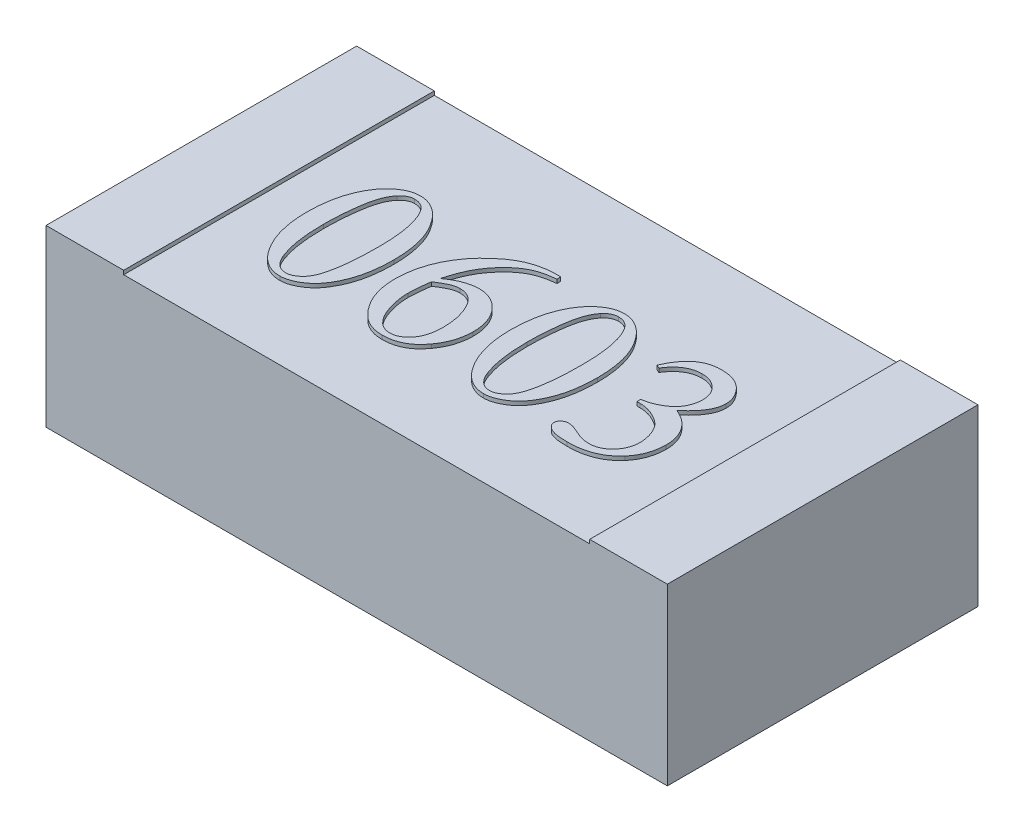
from build123d import *

# Parameters (mm, degrees)
SKETCH_1_W          = 1.6
SKETCH_1_H          = 0.8
EXTRUDE_1_DEPTH     = 0.45
SKETCH_2_W          = 1.2
SKETCH_2_H          = 0.8
CUT_EXTRUDE_1_DEPTH = 0.01
EXTRUDE_2_DEPTH     = 0.01


with BuildPart() as part:
    # 草图1 → 凸台-拉伸1 (new body)
    with BuildSketch(Plane(origin=(0, 0, 0), x_dir=(1, 0, 0), z_dir=(0, 1, 0))):
        Rectangle(SKETCH_1_W, SKETCH_1_H)
    extrude(amount=EXTRUDE_1_DEPTH)

    # 草图2 → 切除-拉伸1 (cut)
    with BuildSketch(Plane(origin=(0, 0.45, 0), x_dir=(1, 0, 0), z_dir=(0, 1, 0))):
        Rectangle(SKETCH_2_W, SKETCH_2_H)
    extrude(amount=-CUT_EXTRUDE_1_DEPTH, mode=Mode.SUBTRACT)

    # 草图3 → 凸台-拉伸2 (add)
    # profile 1 of 4: a face of its own
    with BuildSketch(Plane(origin=(0, 0.44, 0), x_dir=(1, 0, 0), z_dir=(0, 1, 0))):
        with BuildLine():
            add(Edge.make_bspline(
                [(-0.494038629, -0.034463866), (-0.493968385, -0.029601954), (-0.493830375, -0.020049566), (-0.493097196, -0.00598145), (-0.49173956, 0.00758151), (-0.48974573, 0.020598735), (-0.487324602, 0.033124998), (-0.484397191, 0.045135649), (-0.48080673, 0.056611876), (-0.476729874, 0.067545349), (-0.47212909, 0.077848338), (-0.4673588, 0.087614212), (-0.461962002, 0.096578117), (-0.456392899, 0.104936504), (-0.450451285, 0.112626124), (-0.44401515, 0.119496867), (-0.437397972, 0.125899304), (-0.432554568, 0.129544074), (-0.43016059, 0.131345596)],
                knots=[0, 0, 0, 0, 1.267948223, 2.491187271, 3.672419621, 4.820944812, 5.924168987, 6.998668076, 8.042818115, 9.058224754, 10.039662809, 10.984530588, 11.890392543, 12.765710998, 13.603053422, 14.420720048, 15.219399938, 16, 16, 16, 16], degree=3))
            add(Edge.make_bspline(
                [(-0.43016059, 0.131345596), (-0.426460667, 0.133901348), (-0.419303869, 0.138844964), (-0.407628386, 0.144027973), (-0.395809297, 0.147342191), (-0.387798717, 0.147768435), (-0.383828125, 0.14797971)],
                knots=[0, 0, 0, 0, 1.076116545, 2.081542914, 3.049081206, 4, 4, 4, 4], degree=3))
            add(Edge.make_bspline(
                [(-0.383828125, 0.14797971), (-0.380602993, 0.147871194), (-0.374196746, 0.147655644), (-0.364741001, 0.145658828), (-0.355548113, 0.142447415), (-0.346637275, 0.137912728), (-0.337975948, 0.132147443), (-0.329609283, 0.125083767), (-0.32145717, 0.11680222), (-0.316500602, 0.110557678), (-0.313949653, 0.10734386)],
                knots=[0, 0, 0, 0, 0.921550053, 1.830522441, 2.751246923, 3.70019056, 4.682375705, 5.720881843, 6.827028318, 8, 8, 8, 8], degree=3))
            add(Edge.make_bspline(
                [(-0.313949653, 0.10734386), (-0.310851281, 0.103019951), (-0.304595542, 0.094289804), (-0.296671142, 0.079967158), (-0.290130456, 0.064474366), (-0.28459456, 0.047937204), (-0.280503931, 0.030246538), (-0.277451496, 0.011474504), (-0.27562, -0.008425612), (-0.275400849, -0.022079364), (-0.275288629, -0.029071071)],
                knots=[0, 0, 0, 0, 0.883963831, 1.784759013, 2.714530965, 3.677036329, 4.680787027, 5.730006124, 6.837599228, 8, 8, 8, 8], degree=3))
            add(Edge.make_bspline(
                [(-0.275288629, -0.029071071), (-0.275314862, -0.034009796), (-0.275366293, -0.043692257), (-0.276286492, -0.057925108), (-0.277483848, -0.071598322), (-0.279454054, -0.084684381), (-0.281731154, -0.097256968), (-0.284744028, -0.109225305), (-0.288092987, -0.12067522), (-0.292168255, -0.131438282), (-0.296554854, -0.141563279), (-0.301163316, -0.151064686), (-0.306208812, -0.159772786), (-0.311409698, -0.167863328), (-0.316962639, -0.175185097), (-0.3228429, -0.181750886), (-0.329001456, -0.187636907), (-0.335448916, -0.192760025), (-0.341957342, -0.197237708), (-0.348476967, -0.201052244), (-0.354902887, -0.204342763), (-0.361318056, -0.206983185), (-0.367607501, -0.209184335), (-0.373884632, -0.210577087), (-0.380074727, -0.211572593), (-0.384203995, -0.211686054), (-0.386258681, -0.211742512)],
                knots=[0, 0, 0, 0, 1.510050896, 2.960482548, 4.360412811, 5.706191847, 7.006128856, 8.266230485, 9.478809624, 10.652394328, 11.782968825, 12.852979618, 13.879641343, 14.858961868, 15.792780312, 16.68657793, 17.551917979, 18.394760493, 19.202293251, 19.965865945, 20.70343888, 21.408045917, 22.086293389, 22.738035093, 23.372058038, 24, 24, 24, 24], degree=3))
            add(Edge.make_bspline(
                [(-0.386258681, -0.211742512), (-0.390225217, -0.211573656), (-0.398077835, -0.211239369), (-0.409564014, -0.20835636), (-0.420563402, -0.203783309), (-0.430945682, -0.197188669), (-0.440827646, -0.188865434), (-0.450202369, -0.17873638), (-0.459015025, -0.166755835), (-0.464171682, -0.157867992), (-0.466846788, -0.153257269)],
                knots=[0, 0, 0, 0, 0.907345466, 1.796286953, 2.695609492, 3.62566933, 4.601329434, 5.647644493, 6.779674527, 8, 8, 8, 8], degree=3))
            add(Edge.make_bspline(
                [(-0.466846788, -0.153257269), (-0.469038525, -0.149085635), (-0.473464084, -0.140662264), (-0.478958835, -0.127335906), (-0.483612612, -0.113372447), (-0.487351251, -0.098788755), (-0.490450195, -0.083617174), (-0.492541655, -0.067806451), (-0.493749467, -0.051344877), (-0.493941014, -0.040162505), (-0.494038629, -0.034463866)],
                knots=[0, 0, 0, 0, 0.917887123, 1.853399498, 2.805111979, 3.783983157, 4.785434396, 5.820907986, 6.889514713, 8, 8, 8, 8], degree=3))
        make_face()
        with BuildLine():
            add(Edge.make_bspline(
                [(-0.445427517, -0.040540255), (-0.445356915, -0.046439985), (-0.445218985, -0.057965788), (-0.444503443, -0.074818119), (-0.443115203, -0.09082809), (-0.441243882, -0.106009818), (-0.438819155, -0.120381532), (-0.435890334, -0.13393365), (-0.432334491, -0.146633595), (-0.429493594, -0.154714095), (-0.428109809, -0.158650064)],
                knots=[0, 0, 0, 0, 1.180112402, 2.305485676, 3.372849049, 4.393553838, 5.364293091, 6.287088038, 7.165649773, 8, 8, 8, 8], degree=3))
            add(Edge.make_bspline(
                [(-0.428109809, -0.158650064), (-0.426908315, -0.161692293), (-0.424615523, -0.16749773), (-0.420326325, -0.175348484), (-0.415719637, -0.182075679), (-0.410564245, -0.187545378), (-0.405006634, -0.191926344), (-0.398875489, -0.194884758), (-0.39237794, -0.196837466), (-0.387868027, -0.197050743), (-0.385575087, -0.197159178)],
                knots=[0, 0, 0, 0, 1.27796888, 2.438728037, 3.490730404, 4.457262314, 5.368188585, 6.240469892, 7.105415757, 8, 8, 8, 8], degree=3))
            add(Edge.make_bspline(
                [(-0.385575087, -0.197159178), (-0.383278361, -0.197007611), (-0.378519322, -0.196693548), (-0.371422975, -0.194149005), (-0.36433268, -0.190060233), (-0.358405273, -0.185664446), (-0.353885542, -0.181192601), (-0.350475406, -0.177332518), (-0.34748734, -0.172774178), (-0.344603026, -0.167787617), (-0.341914658, -0.162262911), (-0.339534637, -0.156203815), (-0.337288407, -0.149623495), (-0.336073947, -0.145012171), (-0.335444879, -0.142623588)],
                knots=[0, 0, 0, 0, 1.037825602, 2.150474477, 3.371635047, 4.73778764, 5.475301301, 6.247273825, 7.064217381, 7.93705097, 8.854564737, 9.842063216, 10.882227619, 12, 12, 12, 12], degree=3))
            add(Edge.make_bspline(
                [(-0.335444879, -0.142623588), (-0.334493327, -0.138733246), (-0.332507988, -0.130616348), (-0.330227438, -0.11777594), (-0.328237237, -0.103818706), (-0.326696926, -0.088712825), (-0.325387118, -0.072456785), (-0.324505549, -0.05508111), (-0.323961983, -0.036568854), (-0.323920921, -0.023855913), (-0.32389974, -0.017298067)],
                knots=[0, 0, 0, 0, 0.761713504, 1.589256053, 2.479498212, 3.443272477, 4.477217009, 5.58167292, 6.752529866, 8, 8, 8, 8], degree=3))
            add(Edge.make_bspline(
                [(-0.32389974, -0.017298067), (-0.323913529, -0.012410805), (-0.323940618, -0.002809437), (-0.324606637, 0.011269921), (-0.325479238, 0.024722516), (-0.326747171, 0.037548694), (-0.328518667, 0.049725059), (-0.330547367, 0.061311068), (-0.332943363, 0.072270744), (-0.334929941, 0.079299933), (-0.335900608, 0.082734485)],
                knots=[0, 0, 0, 0, 1.160165125, 2.279225349, 3.345596166, 4.360583534, 5.338162882, 6.266121345, 7.152804842, 8, 8, 8, 8], degree=3))
            add(Edge.make_bspline(
                [(-0.335900608, 0.082734485), (-0.336663726, 0.085121794), (-0.338144231, 0.089753351), (-0.340655225, 0.09636963), (-0.343312686, 0.102454571), (-0.346092994, 0.108045259), (-0.349163487, 0.113023041), (-0.352227109, 0.11757216), (-0.355614905, 0.121474068), (-0.358035891, 0.123768436), (-0.35921875, 0.124889433)],
                knots=[0, 0, 0, 0, 1.233545328, 2.393169741, 3.481419258, 4.501374537, 5.463177041, 6.358578008, 7.198024365, 8, 8, 8, 8], degree=3))
            add(Edge.make_bspline(
                [(-0.35921875, 0.124889433), (-0.360972051, 0.126202702), (-0.364462914, 0.128817453), (-0.370551346, 0.131470152), (-0.377132924, 0.133108802), (-0.381716701, 0.133299206), (-0.38405599, 0.133396377)],
                knots=[0, 0, 0, 0, 0.978770933, 1.948756365, 2.953166656, 4, 4, 4, 4], degree=3))
            add(Edge.make_bspline(
                [(-0.38405599, 0.133396377), (-0.386843428, 0.133209014), (-0.392427541, 0.132833668), (-0.400445441, 0.129653603), (-0.407932695, 0.124563456), (-0.412145645, 0.119999012), (-0.414361979, 0.117597766)],
                knots=[0, 0, 0, 0, 0.945219573, 1.893571615, 2.891857598, 4, 4, 4, 4], degree=3))
            add(Edge.make_bspline(
                [(-0.414361979, 0.117597766), (-0.415844932, 0.115701487), (-0.418883336, 0.111816222), (-0.422819359, 0.105243214), (-0.426480628, 0.097978575), (-0.429622505, 0.089859885), (-0.432497899, 0.081033545), (-0.435120741, 0.071443365), (-0.43716864, 0.061046419), (-0.439572467, 0.04627263), (-0.441932965, 0.027359209), (-0.44382426, 0.004599453), (-0.445254952, -0.018014304), (-0.445370089, -0.033043792), (-0.445427517, -0.040540255)],
                knots=[0, 0, 0, 0, 0.529149883, 1.084168889, 1.682003891, 2.317081463, 2.996986461, 3.723908646, 4.502772949, 5.326906926, 7.016784336, 8.694047759, 10.351045161, 12, 12, 12, 12], degree=3))
        make_face(mode=Mode.SUBTRACT)
    # profile 2 of 4: a face of its own
    with BuildSketch(Plane(origin=(0, 0.44, 0), x_dir=(1, 0, 0), z_dir=(0, 1, 0))):
        with BuildLine():
            Line((-0.022510851, 0.14797971), (-0.022510851, 0.138257488))
            add(Edge.make_bspline(
                [(-0.022510851, 0.138257488), (-0.027761864, 0.1376464), (-0.037837491, 0.136473846), (-0.052137548, 0.133641605), (-0.064907179, 0.129820834), (-0.07645116, 0.125229403), (-0.087112569, 0.119395764), (-0.097503814, 0.11242483), (-0.107811591, 0.104105607), (-0.117940804, 0.094638449), (-0.127592617, 0.084235875), (-0.136500161, 0.073116074), (-0.144581937, 0.061408711), (-0.151776632, 0.048982031), (-0.158211413, 0.035664422), (-0.164018947, 0.021288676), (-0.169375173, 0.005753798), (-0.172354896, -0.005101548), (-0.173888889, -0.010689994)],
                knots=[0, 0, 0, 0, 1.112103864, 2.133901259, 3.062589416, 3.913366634, 4.74287887, 5.614630287, 6.543135065, 7.526908882, 8.529641219, 9.526369413, 10.522342764, 11.520138158, 12.544667767, 13.631892204, 14.7808733, 16, 16, 16, 16], degree=3))
            add(Edge.make_bspline(
                [(-0.173888889, -0.010689994), (-0.170856751, -0.008491322), (-0.164926914, -0.004191462), (-0.15567996, 0.001343595), (-0.146477483, 0.006081832), (-0.13727824, 0.009995845), (-0.128019942, 0.012977439), (-0.118768443, 0.015089307), (-0.109493998, 0.016453305), (-0.103306103, 0.016637586), (-0.100212674, 0.01672971)],
                knots=[0, 0, 0, 0, 1.123331773, 2.196857368, 3.229697486, 4.227207333, 5.192971132, 6.143860852, 7.072085882, 8, 8, 8, 8], degree=3))
            add(Edge.make_bspline(
                [(-0.100212674, 0.01672971), (-0.097295313, 0.016646342), (-0.091554159, 0.01648228), (-0.083097452, 0.015050945), (-0.074941196, 0.012782636), (-0.067065761, 0.009568771), (-0.059529318, 0.005423717), (-0.052230754, 0.000440697), (-0.04525657, -0.005490294), (-0.03870589, -0.01231295), (-0.032643375, -0.019782303), (-0.027296034, -0.027855459), (-0.022813409, -0.036468278), (-0.019142147, -0.045604703), (-0.016263001, -0.055239634), (-0.014220659, -0.065408129), (-0.012978153, -0.076081272), (-0.0128527, -0.08337536), (-0.012788629, -0.087100585)],
                knots=[0, 0, 0, 0, 0.926335326, 1.822960257, 2.716874761, 3.611657495, 4.518793541, 5.44474459, 6.414990309, 7.421923668, 8.445808242, 9.467636789, 10.493068566, 11.525261677, 12.591619706, 13.683314711, 14.816826316, 16, 16, 16, 16], degree=3))
            add(Edge.make_bspline(
                [(-0.012788629, -0.087100585), (-0.012845904, -0.09075078), (-0.012959238, -0.097973692), (-0.014341084, -0.108657689), (-0.016381684, -0.11908993), (-0.019168526, -0.129327068), (-0.022924349, -0.139298751), (-0.027521254, -0.149020244), (-0.032787982, -0.158573811), (-0.036964041, -0.16458351), (-0.039069011, -0.167612737)],
                knots=[0, 0, 0, 0, 1.016603262, 2.01162791, 2.996823361, 3.9776384, 4.964449423, 5.961847612, 6.972656258, 8, 8, 8, 8], degree=3))
            add(Edge.make_bspline(
                [(-0.039069011, -0.167612737), (-0.041724473, -0.171122744), (-0.046920797, -0.177991279), (-0.055898356, -0.186967699), (-0.065441124, -0.194665286), (-0.075666609, -0.200950706), (-0.086575853, -0.205738414), (-0.098053059, -0.209291825), (-0.110214573, -0.211360874), (-0.118535332, -0.211613768), (-0.122771267, -0.211742512)],
                knots=[0, 0, 0, 0, 1.070547348, 2.094894131, 3.081678243, 4.0500961, 5.007721965, 5.97488336, 6.96905275, 8, 8, 8, 8], degree=3))
            add(Edge.make_bspline(
                [(-0.122771267, -0.211742512), (-0.125686047, -0.211665925), (-0.131408715, -0.21151556), (-0.139829051, -0.210436545), (-0.147898269, -0.208627555), (-0.155635027, -0.206025576), (-0.16301632, -0.202649253), (-0.170116434, -0.198632413), (-0.176831983, -0.193835433), (-0.180935956, -0.190136116), (-0.183003472, -0.18827246)],
                knots=[0, 0, 0, 0, 1.054945317, 2.071203223, 3.06725916, 4.043942597, 5.020109906, 6.001126647, 6.992999677, 8, 8, 8, 8], degree=3))
            add(Edge.make_bspline(
                [(-0.183003472, -0.18827246), (-0.186893385, -0.184406284), (-0.194601454, -0.176745251), (-0.20444698, -0.163893557), (-0.212822248, -0.150247996), (-0.219660268, -0.135778838), (-0.225029515, -0.120458282), (-0.228786061, -0.104287278), (-0.23112649, -0.087270378), (-0.231399426, -0.07563912), (-0.231538629, -0.069706921)],
                knots=[0, 0, 0, 0, 0.996887487, 1.97538571, 2.93683217, 3.905260266, 4.881326787, 5.88466394, 6.921131994, 8, 8, 8, 8], degree=3))
            add(Edge.make_bspline(
                [(-0.231538629, -0.069706921), (-0.231474495, -0.065857109), (-0.231346924, -0.058199256), (-0.230496205, -0.046763785), (-0.229076128, -0.035476726), (-0.226982264, -0.024333616), (-0.22442503, -0.013351727), (-0.221292763, -0.002497091), (-0.217577581, 0.008207114), (-0.213245506, 0.018745813), (-0.208380878, 0.029050777), (-0.203080053, 0.039116499), (-0.197181463, 0.048834682), (-0.1909264, 0.058326882), (-0.184100713, 0.067480024), (-0.176856884, 0.076377128), (-0.168962369, 0.084865646), (-0.160793815, 0.093093316), (-0.152318187, 0.100754645), (-0.143921827, 0.107890186), (-0.135635397, 0.114388126), (-0.127402084, 0.120162759), (-0.119293906, 0.125356678), (-0.111230058, 0.129850435), (-0.103266315, 0.133665135), (-0.092907402, 0.137733834), (-0.080275958, 0.141797009), (-0.065416492, 0.145296171), (-0.051090002, 0.147578663), (-0.04168473, 0.147848169), (-0.037094184, 0.14797971)],
                knots=[0, 0, 0, 0, 1.006519091, 2.00211706, 2.996415824, 3.979256571, 4.965124328, 5.943496579, 6.931606334, 7.926081361, 8.921040949, 9.910081525, 10.898878399, 11.892118928, 12.881093046, 13.88292124, 14.890158396, 15.910556394, 16.913324523, 17.876166787, 18.79114971, 19.665330668, 20.504552116, 21.307593167, 22.077426548, 22.811271048, 24.215940873, 25.542181098, 26.800382202, 28, 28, 28, 28], degree=3))
            Line((-0.037094184, 0.14797971), (-0.022510851, 0.14797971))
        make_face()
        with BuildLine():
            add(Edge.make_bspline(
                [(-0.178066406, -0.029450845), (-0.1788074, -0.034941123), (-0.180215622, -0.045375127), (-0.181718563, -0.060218812), (-0.182719548, -0.073415045), (-0.182861296, -0.081655669), (-0.182927517, -0.085505533)],
                knots=[0, 0, 0, 0, 1.180646981, 2.243761695, 3.179518763, 4, 4, 4, 4], degree=3))
            add(Edge.make_bspline(
                [(-0.182927517, -0.085505533), (-0.182826551, -0.089713778), (-0.182619607, -0.09833912), (-0.180821912, -0.11150892), (-0.178094438, -0.12521698), (-0.174291092, -0.139141529), (-0.169561376, -0.152678965), (-0.163550382, -0.165022942), (-0.156424214, -0.175894389), (-0.150708348, -0.182064253), (-0.147912327, -0.185082355)],
                knots=[0, 0, 0, 0, 0.935169282, 1.916749931, 2.94995263, 4.040933046, 5.12340098, 6.132811626, 7.086630455, 8, 8, 8, 8], degree=3))
            add(Edge.make_bspline(
                [(-0.147912327, -0.185082355), (-0.145756904, -0.186960226), (-0.141518357, -0.19065298), (-0.133906539, -0.19435027), (-0.12572998, -0.196763695), (-0.12000435, -0.197025313), (-0.117074653, -0.197159178)],
                knots=[0, 0, 0, 0, 1.006861896, 1.979951003, 2.966379127, 4, 4, 4, 4], degree=3))
            add(Edge.make_bspline(
                [(-0.117074653, -0.197159178), (-0.115298338, -0.197104681), (-0.11174318, -0.196995608), (-0.106498018, -0.19599168), (-0.101425752, -0.194257585), (-0.096466473, -0.192015806), (-0.091710998, -0.188967889), (-0.087093855, -0.185317622), (-0.08257992, -0.181032768), (-0.078287157, -0.176101571), (-0.074213142, -0.170612089), (-0.070855305, -0.16437683), (-0.06783502, -0.157705293), (-0.065535082, -0.150395888), (-0.063591582, -0.142594224), (-0.06237991, -0.134170573), (-0.061476029, -0.12522429), (-0.06142562, -0.119054839), (-0.06139974, -0.115887477)],
                knots=[0, 0, 0, 0, 0.779018414, 1.559145301, 2.332118556, 3.127524297, 3.941341095, 4.803764059, 5.707564093, 6.668110459, 7.67041715, 8.699942935, 9.769402819, 10.879695731, 12.057326098, 13.294013432, 14.610761405, 16, 16, 16, 16], degree=3))
            add(Edge.make_bspline(
                [(-0.06139974, -0.115887477), (-0.061428629, -0.112290342), (-0.061485675, -0.105187095), (-0.062381653, -0.094746597), (-0.063649764, -0.084652518), (-0.065436636, -0.074921228), (-0.067912232, -0.065583891), (-0.070768065, -0.056585069), (-0.074200014, -0.04798325), (-0.078100573, -0.039843467), (-0.082446875, -0.032306307), (-0.087329496, -0.02568879), (-0.092748185, -0.020164455), (-0.098446485, -0.015464832), (-0.104774716, -0.012017559), (-0.11142208, -0.009320551), (-0.118611725, -0.007912329), (-0.123525631, -0.00768966), (-0.126037327, -0.007575845)],
                knots=[0, 0, 0, 0, 1.23656911, 2.44184803, 3.600569917, 4.734395033, 5.84091625, 6.920215375, 7.979166598, 9.022759962, 10.02170957, 10.967214311, 11.841492347, 12.677704233, 13.49628075, 14.309515386, 15.135925349, 16, 16, 16, 16], degree=3))
            add(Edge.make_bspline(
                [(-0.126037327, -0.007575845), (-0.129297671, -0.007780749), (-0.136206164, -0.00821493), (-0.144956523, -0.0109905), (-0.152785669, -0.014528137), (-0.160153933, -0.01831524), (-0.168694705, -0.023486881), (-0.174783515, -0.027361678), (-0.178066406, -0.029450845)],
                knots=[0, 0, 0, 0, 1.024860307, 2.171623077, 2.859911253, 3.729199811, 4.775657197, 6, 6, 6, 6], degree=3))
        make_face(mode=Mode.SUBTRACT)
    # profile 3 of 4: a face of its own
    with BuildSketch(Plane(origin=(0, 0.44, 0), x_dir=(1, 0, 0), z_dir=(0, 1, 0))):
        with BuildLine():
            add(Edge.make_bspline(
                [(0.030961371, -0.034463866), (0.031031615, -0.029601954), (0.031169625, -0.020049566), (0.031902804, -0.00598145), (0.03326044, 0.00758151), (0.03525427, 0.020598735), (0.037675398, 0.033124998), (0.040602809, 0.045135649), (0.04419327, 0.056611876), (0.048270126, 0.067545349), (0.05287091, 0.077848338), (0.0576412, 0.087614212), (0.063037998, 0.096578117), (0.068607101, 0.104936504), (0.074548715, 0.112626124), (0.08098485, 0.119496867), (0.087602028, 0.125899304), (0.092445432, 0.129544074), (0.09483941, 0.131345596)],
                knots=[0, 0, 0, 0, 1.267948223, 2.491187271, 3.672419621, 4.820944812, 5.924168987, 6.998668076, 8.042818115, 9.058224754, 10.039662809, 10.984530588, 11.890392543, 12.765710998, 13.603053422, 14.420720048, 15.219399938, 16, 16, 16, 16], degree=3))
            add(Edge.make_bspline(
                [(0.09483941, 0.131345596), (0.098539333, 0.133901348), (0.105696131, 0.138844964), (0.117371614, 0.144027973), (0.129190703, 0.147342191), (0.137201283, 0.147768435), (0.141171875, 0.14797971)],
                knots=[0, 0, 0, 0, 1.076116545, 2.081542914, 3.049081206, 4, 4, 4, 4], degree=3))
            add(Edge.make_bspline(
                [(0.141171875, 0.14797971), (0.144397007, 0.147871194), (0.150803254, 0.147655644), (0.160258999, 0.145658828), (0.169451887, 0.142447415), (0.178362725, 0.137912728), (0.187024052, 0.132147443), (0.195390717, 0.125083767), (0.20354283, 0.11680222), (0.208499398, 0.110557678), (0.211050347, 0.10734386)],
                knots=[0, 0, 0, 0, 0.921550053, 1.830522441, 2.751246923, 3.70019056, 4.682375705, 5.720881843, 6.827028318, 8, 8, 8, 8], degree=3))
            add(Edge.make_bspline(
                [(0.211050347, 0.10734386), (0.214148719, 0.103019951), (0.220404458, 0.094289804), (0.228328858, 0.079967158), (0.234869544, 0.064474366), (0.24040544, 0.047937204), (0.244496069, 0.030246538), (0.247548504, 0.011474504), (0.24938, -0.008425612), (0.249599151, -0.022079364), (0.249711371, -0.029071071)],
                knots=[0, 0, 0, 0, 0.883963831, 1.784759013, 2.714530965, 3.677036329, 4.680787027, 5.730006124, 6.837599228, 8, 8, 8, 8], degree=3))
            add(Edge.make_bspline(
                [(0.249711371, -0.029071071), (0.249685138, -0.034009796), (0.249633707, -0.043692257), (0.248713508, -0.057925108), (0.247516152, -0.071598322), (0.245545946, -0.084684381), (0.243268846, -0.097256968), (0.240255972, -0.109225305), (0.236907013, -0.12067522), (0.232831745, -0.131438282), (0.228445146, -0.141563279), (0.223836684, -0.151064686), (0.218791188, -0.159772786), (0.213590302, -0.167863328), (0.208037361, -0.175185097), (0.2021571, -0.181750886), (0.195998544, -0.187636907), (0.189551084, -0.192760025), (0.183042658, -0.197237708), (0.176523033, -0.201052244), (0.170097113, -0.204342763), (0.163681944, -0.206983185), (0.157392499, -0.209184335), (0.151115368, -0.210577087), (0.144925273, -0.211572593), (0.140796005, -0.211686054), (0.138741319, -0.211742512)],
                knots=[0, 0, 0, 0, 1.510050896, 2.960482548, 4.360412811, 5.706191847, 7.006128856, 8.266230485, 9.478809624, 10.652394328, 11.782968825, 12.852979618, 13.879641343, 14.858961868, 15.792780312, 16.68657793, 17.551917979, 18.394760493, 19.202293251, 19.965865945, 20.70343888, 21.408045917, 22.086293389, 22.738035093, 23.372058038, 24, 24, 24, 24], degree=3))
            add(Edge.make_bspline(
                [(0.138741319, -0.211742512), (0.134774783, -0.211573656), (0.126922165, -0.211239369), (0.115435986, -0.20835636), (0.104436598, -0.203783309), (0.094054318, -0.197188669), (0.084172354, -0.188865434), (0.074797631, -0.17873638), (0.065984975, -0.166755835), (0.060828318, -0.157867992), (0.058153212, -0.153257269)],
                knots=[0, 0, 0, 0, 0.907345466, 1.796286953, 2.695609492, 3.62566933, 4.601329434, 5.647644493, 6.779674527, 8, 8, 8, 8], degree=3))
            add(Edge.make_bspline(
                [(0.058153212, -0.153257269), (0.055961475, -0.149085635), (0.051535916, -0.140662264), (0.046041165, -0.127335906), (0.041387388, -0.113372447), (0.037648749, -0.098788755), (0.034549805, -0.083617174), (0.032458345, -0.067806451), (0.031250533, -0.051344877), (0.031058986, -0.040162505), (0.030961371, -0.034463866)],
                knots=[0, 0, 0, 0, 0.917887123, 1.853399498, 2.805111979, 3.783983157, 4.785434396, 5.820907986, 6.889514713, 8, 8, 8, 8], degree=3))
        make_face()
        with BuildLine():
            add(Edge.make_bspline(
                [(0.079572483, -0.040540255), (0.079643085, -0.046439985), (0.079781015, -0.057965788), (0.080496557, -0.074818119), (0.081884797, -0.09082809), (0.083756118, -0.106009818), (0.086180845, -0.120381532), (0.089109666, -0.13393365), (0.092665509, -0.146633595), (0.095506406, -0.154714095), (0.096890191, -0.158650064)],
                knots=[0, 0, 0, 0, 1.180112402, 2.305485676, 3.372849049, 4.393553838, 5.364293091, 6.287088038, 7.165649773, 8, 8, 8, 8], degree=3))
            add(Edge.make_bspline(
                [(0.096890191, -0.158650064), (0.098091685, -0.161692293), (0.100384477, -0.16749773), (0.104673675, -0.175348484), (0.109280363, -0.182075679), (0.114435755, -0.187545378), (0.119993366, -0.191926344), (0.126124511, -0.194884758), (0.13262206, -0.196837466), (0.137131973, -0.197050743), (0.139424913, -0.197159178)],
                knots=[0, 0, 0, 0, 1.27796888, 2.438728037, 3.490730404, 4.457262314, 5.368188585, 6.240469892, 7.105415757, 8, 8, 8, 8], degree=3))
            add(Edge.make_bspline(
                [(0.139424913, -0.197159178), (0.141721639, -0.197007611), (0.146480678, -0.196693548), (0.153577025, -0.194149005), (0.16066732, -0.190060233), (0.166594727, -0.185664446), (0.171114458, -0.181192601), (0.174524594, -0.177332518), (0.17751266, -0.172774178), (0.180396974, -0.167787617), (0.183085342, -0.162262911), (0.185465363, -0.156203815), (0.187711593, -0.149623495), (0.188926053, -0.145012171), (0.189555121, -0.142623588)],
                knots=[0, 0, 0, 0, 1.037825602, 2.150474477, 3.371635047, 4.73778764, 5.475301301, 6.247273825, 7.064217381, 7.93705097, 8.854564737, 9.842063216, 10.882227619, 12, 12, 12, 12], degree=3))
            add(Edge.make_bspline(
                [(0.189555121, -0.142623588), (0.190506673, -0.138733246), (0.192492012, -0.130616348), (0.194772562, -0.11777594), (0.196762763, -0.103818706), (0.198303074, -0.088712825), (0.199612882, -0.072456785), (0.200494451, -0.05508111), (0.201038017, -0.036568854), (0.201079079, -0.023855913), (0.20110026, -0.017298067)],
                knots=[0, 0, 0, 0, 0.761713504, 1.589256053, 2.479498212, 3.443272477, 4.477217009, 5.58167292, 6.752529866, 8, 8, 8, 8], degree=3))
            add(Edge.make_bspline(
                [(0.20110026, -0.017298067), (0.201086471, -0.012410805), (0.201059382, -0.002809437), (0.200393363, 0.011269921), (0.199520762, 0.024722516), (0.198252829, 0.037548694), (0.196481333, 0.049725059), (0.194452633, 0.061311068), (0.192056637, 0.072270744), (0.190070059, 0.079299933), (0.189099392, 0.082734485)],
                knots=[0, 0, 0, 0, 1.160165125, 2.279225349, 3.345596166, 4.360583534, 5.338162882, 6.266121345, 7.152804842, 8, 8, 8, 8], degree=3))
            add(Edge.make_bspline(
                [(0.189099392, 0.082734485), (0.188336274, 0.085121794), (0.186855769, 0.089753351), (0.184344775, 0.09636963), (0.181687314, 0.102454571), (0.178907006, 0.108045259), (0.175836513, 0.113023041), (0.172772891, 0.11757216), (0.169385095, 0.121474068), (0.166964109, 0.123768436), (0.16578125, 0.124889433)],
                knots=[0, 0, 0, 0, 1.233545328, 2.393169741, 3.481419258, 4.501374537, 5.463177041, 6.358578008, 7.198024365, 8, 8, 8, 8], degree=3))
            add(Edge.make_bspline(
                [(0.16578125, 0.124889433), (0.164027949, 0.126202702), (0.160537086, 0.128817453), (0.154448654, 0.131470152), (0.147867076, 0.133108802), (0.143283299, 0.133299206), (0.14094401, 0.133396377)],
                knots=[0, 0, 0, 0, 0.978770933, 1.948756365, 2.953166656, 4, 4, 4, 4], degree=3))
            add(Edge.make_bspline(
                [(0.14094401, 0.133396377), (0.138156572, 0.133209014), (0.132572459, 0.132833668), (0.124554559, 0.129653603), (0.117067305, 0.124563456), (0.112854355, 0.119999012), (0.110638021, 0.117597766)],
                knots=[0, 0, 0, 0, 0.945219573, 1.893571615, 2.891857598, 4, 4, 4, 4], degree=3))
            add(Edge.make_bspline(
                [(0.110638021, 0.117597766), (0.109155068, 0.115701487), (0.106116664, 0.111816222), (0.102180641, 0.105243214), (0.098519372, 0.097978575), (0.095377495, 0.089859885), (0.092502101, 0.081033545), (0.089879259, 0.071443365), (0.08783136, 0.061046419), (0.085427533, 0.04627263), (0.083067035, 0.027359209), (0.08117574, 0.004599453), (0.079745048, -0.018014304), (0.079629911, -0.033043792), (0.079572483, -0.040540255)],
                knots=[0, 0, 0, 0, 0.529149883, 1.084168889, 1.682003891, 2.317081463, 2.996986461, 3.723908646, 4.502772949, 5.326906926, 7.016784336, 8.694047759, 10.351045161, 12, 12, 12, 12], degree=3))
        make_face(mode=Mode.SUBTRACT)
    # profile 4 of 4: a face of its own
    with BuildSketch(Plane(origin=(0, 0.44, 0), x_dir=(1, 0, 0), z_dir=(0, 1, 0))):
        with BuildLine():
            add(Edge.make_bspline(
                [(0.298322483, 0.075063044), (0.299592743, 0.077908257), (0.30207704, 0.08347275), (0.306085549, 0.091496887), (0.310463677, 0.098978947), (0.315037166, 0.105988226), (0.319872062, 0.112492436), (0.324857019, 0.118536189), (0.33021476, 0.12399375), (0.335753458, 0.129040232), (0.341588806, 0.133581315), (0.347880872, 0.137351514), (0.354448513, 0.140649309), (0.361344161, 0.143402216), (0.36863028, 0.145453067), (0.376235923, 0.146854352), (0.384177572, 0.147821265), (0.389591916, 0.147926178), (0.392354601, 0.14797971)],
                knots=[0, 0, 0, 0, 1.176091227, 2.300127321, 3.3835767, 4.446473798, 5.457585235, 6.441364894, 7.401036819, 8.341531155, 9.268576939, 10.186414906, 11.105297085, 12.040532869, 12.984371496, 13.957134865, 14.957622323, 16, 16, 16, 16], degree=3))
            add(Edge.make_bspline(
                [(0.392354601, 0.14797971), (0.395724873, 0.147880888), (0.402310406, 0.147687789), (0.411892125, 0.146516101), (0.420869517, 0.144352859), (0.429238845, 0.141418328), (0.437023834, 0.13760756), (0.444081096, 0.1328051), (0.450746459, 0.127392085), (0.454495287, 0.123051373), (0.456384548, 0.120863825)],
                knots=[0, 0, 0, 0, 1.123808988, 2.195929207, 3.211426243, 4.196579678, 5.14788152, 6.09136163, 7.038121192, 8, 8, 8, 8], degree=3))
            add(Edge.make_bspline(
                [(0.456384548, 0.120863825), (0.458994925, 0.11752933), (0.464033592, 0.111092937), (0.469313546, 0.100268617), (0.472711751, 0.089143154), (0.473119495, 0.081517668), (0.473322483, 0.077721464)],
                knots=[0, 0, 0, 0, 1.071729872, 2.068701529, 3.038539469, 4, 4, 4, 4], degree=3))
            add(Edge.make_bspline(
                [(0.473322483, 0.077721464), (0.473172213, 0.074543503), (0.472866733, 0.068083097), (0.47043867, 0.05841451), (0.466592939, 0.048698338), (0.461193815, 0.038929584), (0.454261405, 0.029104616), (0.445886596, 0.019161508), (0.435951807, 0.009183054), (0.428556018, 0.002854016), (0.424711371, -0.000436088)],
                knots=[0, 0, 0, 0, 0.802544778, 1.631475345, 2.504987027, 3.438672434, 4.445331875, 5.540090885, 6.721234327, 8, 8, 8, 8], degree=3))
            add(Edge.make_bspline(
                [(0.424711371, -0.000436088), (0.427259895, -0.001487613), (0.432258692, -0.003550124), (0.439357944, -0.007230286), (0.445936252, -0.011279363), (0.452149392, -0.015493006), (0.457794595, -0.020170412), (0.462959477, -0.025188637), (0.467681482, -0.030520746), (0.47195845, -0.036134711), (0.47568706, -0.042101176), (0.478934105, -0.048333518), (0.481793446, -0.054774067), (0.483972235, -0.06153593), (0.485714805, -0.068516048), (0.487016329, -0.075743822), (0.487796999, -0.08323481), (0.48786912, -0.088313978), (0.487905816, -0.090898328)],
                knots=[0, 0, 0, 0, 1.121628463, 2.200015641, 3.249715177, 4.264389965, 5.252559056, 6.229000805, 7.192526379, 8.148751574, 9.09789992, 10.051957494, 11.00718286, 11.961907919, 12.939056191, 13.933490933, 14.948531889, 16, 16, 16, 16], degree=3))
            add(Edge.make_bspline(
                [(0.487905816, -0.090898328), (0.48781565, -0.094598675), (0.487638463, -0.101870351), (0.486313743, -0.112596767), (0.484147183, -0.122929969), (0.480969066, -0.132871567), (0.477044543, -0.142482807), (0.472142369, -0.15170392), (0.466372178, -0.160556315), (0.461903658, -0.166055366), (0.459650608, -0.168828015)],
                knots=[0, 0, 0, 0, 1.048019005, 2.059496798, 3.056839529, 4.034491814, 5.012117791, 5.993865523, 6.98849678, 8, 8, 8, 8], degree=3))
            add(Edge.make_bspline(
                [(0.459650608, -0.168828015), (0.456491543, -0.172254578), (0.450193051, -0.179086404), (0.43929316, -0.187814585), (0.427426553, -0.195226266), (0.414551794, -0.2013743), (0.400590455, -0.206046024), (0.385622705, -0.209368866), (0.369647067, -0.211359424), (0.358661788, -0.211612372), (0.353009983, -0.211742512)],
                knots=[0, 0, 0, 0, 0.9408645, 1.875880513, 2.811526398, 3.763677692, 4.752375993, 5.780273647, 6.857974994, 8, 8, 8, 8], degree=3))
            add(Edge.make_bspline(
                [(0.353009983, -0.211742512), (0.350249787, -0.211710568), (0.344954566, -0.211649287), (0.337354428, -0.211264701), (0.33043075, -0.210690122), (0.324182816, -0.209809157), (0.318644897, -0.208560471), (0.313739261, -0.207250649), (0.30950901, -0.2056063), (0.305059763, -0.203033386), (0.300546539, -0.199672504), (0.296595257, -0.195224154), (0.293916165, -0.190613366), (0.293609118, -0.187340704), (0.293461371, -0.185765949)],
                knots=[0, 0, 0, 0, 1.402226433, 2.690062984, 3.865046374, 4.930988681, 5.892224942, 6.747350114, 7.509271635, 8.188907461, 9.354277059, 10.347676201, 11.204926872, 12, 12, 12, 12], degree=3))
            add(Edge.make_bspline(
                [(0.293461371, -0.185765949), (0.293537101, -0.184617734), (0.293686878, -0.182346792), (0.294822474, -0.179051579), (0.296656923, -0.175971785), (0.299288789, -0.173289702), (0.302321924, -0.170926571), (0.305805849, -0.169281237), (0.30951418, -0.168110183), (0.312111474, -0.168032283), (0.3134375, -0.167992512)],
                knots=[0, 0, 0, 0, 0.930288779, 1.839927393, 2.798379237, 3.815801145, 4.871906534, 5.901086166, 6.928418261, 8, 8, 8, 8], degree=3))
            add(Edge.make_bspline(
                [(0.3134375, -0.167992512), (0.315547993, -0.168049023), (0.319858649, -0.168164445), (0.324055725, -0.169156946), (0.326197917, -0.169663519)],
                knots=[0, 0, 0, 0, 0.9791981, 2, 2, 2, 2], degree=3))
            add(Edge.make_bspline(
                [(0.326197917, -0.169663519), (0.327136912, -0.16996074), (0.329466024, -0.170697975), (0.333604023, -0.172251477), (0.339049755, -0.174564762), (0.345436317, -0.177342328), (0.35190608, -0.180168198), (0.357659889, -0.182435539), (0.362257425, -0.184109794), (0.364981126, -0.184843426), (0.366150173, -0.18515831)],
                knots=[0, 0, 0, 0, 0.551098561, 1.366961252, 2.47206847, 3.861764831, 5.264472469, 6.422097681, 7.322743916, 8, 8, 8, 8], degree=3))
            add(Edge.make_bspline(
                [(0.366150173, -0.18515831), (0.369304527, -0.185804127), (0.375795092, -0.187132992), (0.382418162, -0.18733376), (0.385822483, -0.187436956)],
                knots=[0, 0, 0, 0, 0.971981303, 2, 2, 2, 2], degree=3))
            add(Edge.make_bspline(
                [(0.385822483, -0.187436956), (0.387928778, -0.187389453), (0.392089483, -0.187295616), (0.398181947, -0.186221796), (0.404089015, -0.184756035), (0.40976804, -0.18250896), (0.415203444, -0.179596769), (0.420517046, -0.176180245), (0.425516121, -0.172033342), (0.430272819, -0.167360524), (0.434616363, -0.162232753), (0.438541142, -0.156873699), (0.441715855, -0.151178547), (0.444420135, -0.145330466), (0.44644243, -0.139204998), (0.448014573, -0.132893672), (0.448820839, -0.126314209), (0.448950975, -0.121864406), (0.449016927, -0.119609265)],
                knots=[0, 0, 0, 0, 0.98287937, 1.941546881, 2.88253887, 3.822638359, 4.785601421, 5.759974566, 6.768635762, 7.814143594, 8.871295523, 9.905298752, 10.911738224, 11.912182368, 12.910876931, 13.920716429, 14.946228209, 16, 16, 16, 16], degree=3))
            add(Edge.make_bspline(
                [(0.449016927, -0.119609265), (0.4489182, -0.116259992), (0.44872112, -0.109574122), (0.447015655, -0.099662896), (0.444508607, -0.0898199), (0.441905404, -0.08352915), (0.440585937, -0.080340602)],
                knots=[0, 0, 0, 0, 0.993065039, 1.982371906, 2.977339071, 4, 4, 4, 4], degree=3))
            add(Edge.make_bspline(
                [(0.440585937, -0.080340602), (0.439565659, -0.078089837), (0.437612197, -0.073780442), (0.434138888, -0.067972169), (0.430739931, -0.062832182), (0.428043951, -0.060027125), (0.426762153, -0.058693467)],
                knots=[0, 0, 0, 0, 1.146959708, 2.196010144, 3.142297047, 4, 4, 4, 4], degree=3))
            add(Edge.make_bspline(
                [(0.426762153, -0.058693467), (0.424924793, -0.056978867), (0.421082003, -0.053392827), (0.414346878, -0.048691406), (0.40669139, -0.044197867), (0.398256286, -0.040020649), (0.389331055, -0.036385126), (0.380093306, -0.033758337), (0.370759729, -0.032216043), (0.364484633, -0.031992522), (0.361365017, -0.031881401)],
                knots=[0, 0, 0, 0, 0.833783525, 1.743836022, 2.720158816, 3.780630828, 4.867413274, 5.916185896, 6.964047963, 8, 8, 8, 8], degree=3))
            Line((0.361365017, -0.031881401), (0.353617621, -0.031881401))
            Line((0.353617621, -0.031881401), (0.353617621, -0.022159178))
            add(Edge.make_bspline(
                [(0.353617621, -0.022159178), (0.357076025, -0.021625489), (0.364077477, -0.020545048), (0.374469279, -0.01751135), (0.384801594, -0.013268253), (0.394983512, -0.008138963), (0.404530049, -0.002131995), (0.412818365, 0.0046897), (0.41976504, 0.012074727), (0.425167817, 0.020117549), (0.429302128, 0.028652526), (0.432286795, 0.037581884), (0.434075395, 0.046939369), (0.434313216, 0.053306967), (0.434433594, 0.056530058)],
                knots=[0, 0, 0, 0, 1.018822759, 2.062581231, 3.144841569, 4.269905924, 5.381171259, 6.423990724, 7.389747841, 8.324839968, 9.23548737, 10.145327579, 11.061219247, 12, 12, 12, 12], degree=3))
            add(Edge.make_bspline(
                [(0.434433594, 0.056530058), (0.434405316, 0.058609753), (0.434349552, 0.062711035), (0.433450359, 0.068675075), (0.432205867, 0.074398457), (0.430273222, 0.079745135), (0.427942121, 0.084859463), (0.424894999, 0.089545543), (0.421534335, 0.09410152), (0.417464654, 0.098109463), (0.413184492, 0.101872242), (0.408498229, 0.105071541), (0.40357114, 0.107772939), (0.39842308, 0.110133303), (0.392980269, 0.111837347), (0.387282502, 0.113050351), (0.381338526, 0.113849454), (0.377267561, 0.113917292), (0.375188802, 0.113951933)],
                knots=[0, 0, 0, 0, 1.07791789, 2.125717433, 3.123144222, 4.111969722, 5.069857656, 6.032059613, 7.006823601, 8.000784083, 8.988212443, 9.96111577, 10.93720663, 11.90155836, 12.894476591, 13.889044549, 14.92208211, 16, 16, 16, 16], degree=3))
            add(Edge.make_bspline(
                [(0.375188802, 0.113951933), (0.371863375, 0.113814871), (0.365279741, 0.113543519), (0.355580345, 0.11153946), (0.346374508, 0.108041722), (0.337490187, 0.103405316), (0.329201372, 0.097196747), (0.321256193, 0.089763681), (0.313685447, 0.080996649), (0.30926552, 0.074380603), (0.306981337, 0.070961481)],
                knots=[0, 0, 0, 0, 0.945780098, 1.8724426, 2.802290766, 3.739917435, 4.713776979, 5.738108685, 6.831072039, 8, 8, 8, 8], degree=3))
            Line((0.306981337, 0.070961481), (0.298322483, 0.075063044))
        make_face()
    extrude(amount=EXTRUDE_2_DEPTH)


solid = part.part
